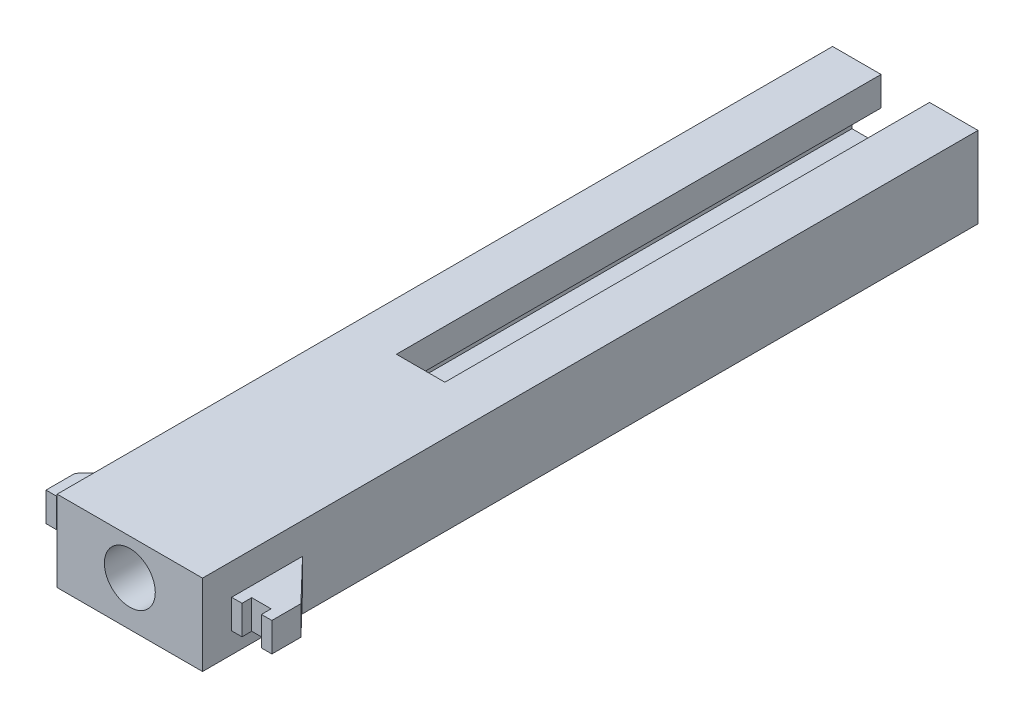
from build123d import *

# Parameters (mm, degrees)
SKETCH9_W           = 15
SKETCH9_H           = 8.35
BOSS_EXTRUDE4_DEPTH = 80
CUT_EXTRUDE4_DEPTH  = 50
SKETCH10_R          = 2.625
CUT_EXTRUDE5_DEPTH  = 30
SKETCH12_W          = 3
SKETCH12_H          = 3
BOSS_EXTRUDE5_DEPTH = 4.15
SKETCH13_W          = 2
SKETCH13_H          = 3
CUT_EXTRUDE6_DEPTH  = 1
BOSS_EXTRUDE6_DEPTH = 3


with BuildPart() as part:
    # Sketch9 → Boss-Extrude4 (new body)
    with BuildSketch(Plane.XY):
        with Locations((0, 4.175)):
            Rectangle(SKETCH9_W, SKETCH9_H)
    extrude(amount=BOSS_EXTRUDE4_DEPTH)

    # Sketch7 → Cut-Extrude4 (cut)
    with BuildSketch(Plane.XY):
        Polygon((-5.5, 2), (-5.5, 5.35), (-2.5, 5.35), (-2.5, 8.35), (2.5, 8.35), (2.5, 5.35), (5.5, 5.35), (5.5, 2), align=None)
    extrude(amount=CUT_EXTRUDE4_DEPTH, mode=Mode.SUBTRACT)

    # Sketch10 → Cut-Extrude5 (cut)
    with BuildSketch(Plane.XY.offset(80)):
        with Locations((0, 4.625)):
            Circle(SKETCH10_R)
    extrude(amount=-CUT_EXTRUDE5_DEPTH, mode=Mode.SUBTRACT)

    # Sketch12 → Boss-Extrude5 (add)
    with BuildSketch(Plane(origin=(7.5, 0, 0), x_dir=(0, 0, -1), z_dir=(1, 0, 0))):
        with Locations((-75.5, 3.64)):
            Rectangle(SKETCH12_W, SKETCH12_H)
    boss_extrude5 = extrude(amount=BOSS_EXTRUDE5_DEPTH)

    # Sketch13 → Cut-Extrude6 (cut)
    with BuildSketch(Plane.XY.offset(77)):
        with Locations((9.575, 3.64)):
            Rectangle(SKETCH13_W, SKETCH13_H)
    cut_extrude6 = extrude(amount=-CUT_EXTRUDE6_DEPTH, mode=Mode.SUBTRACT)

    # Mirror2: Boss-Extrude5 across plane
    add(boss_extrude5.mirror(Plane(origin=(0, 0, 0), x_dir=(0, 0, 1), z_dir=(1, 0, 0))))

    # Mirror4: Cut-Extrude6 across plane
    add(cut_extrude6.mirror(Plane(origin=(0, 0, 0), x_dir=(0, 0, 1), z_dir=(1, 0, 0))), mode=Mode.SUBTRACT)

    # Sketch14 → Boss-Extrude6 (add)
    with BuildSketch(Plane(origin=(0, 5.14, 0), x_dir=(1, 0, 0), z_dir=(0, 1, 0))):
        Polygon((11.65, -74), (7.5, -69.685450349), (7.5, -74), align=None)
    boss_extrude6 = extrude(amount=-BOSS_EXTRUDE6_DEPTH)

    # Mirror5: Boss-Extrude6 across plane
    add(boss_extrude6.mirror(Plane(origin=(0, 0, 0), x_dir=(0, 0, 1), z_dir=(1, 0, 0))))


solid = part.part
